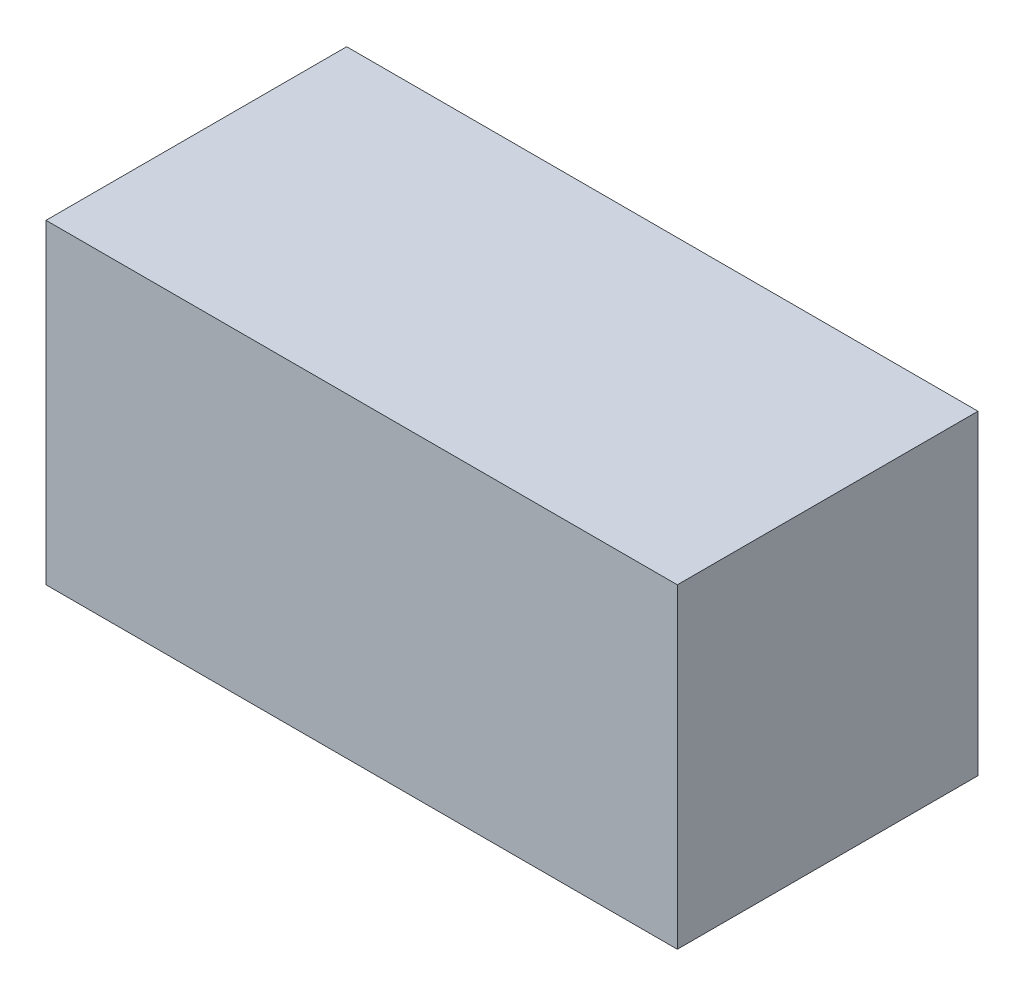
from build123d import *

# Parameters (mm, degrees)
SKETCH1_W           = 1.6
SKETCH1_H           = 0.8
BOSS_EXTRUDE1_DEPTH = 0.762


with BuildPart() as part:
    # Sketch1 → Boss-Extrude1 (new body)
    with BuildSketch(Plane.XY):
        Rectangle(SKETCH1_W, SKETCH1_H)
    extrude(amount=BOSS_EXTRUDE1_DEPTH)


solid = part.part
